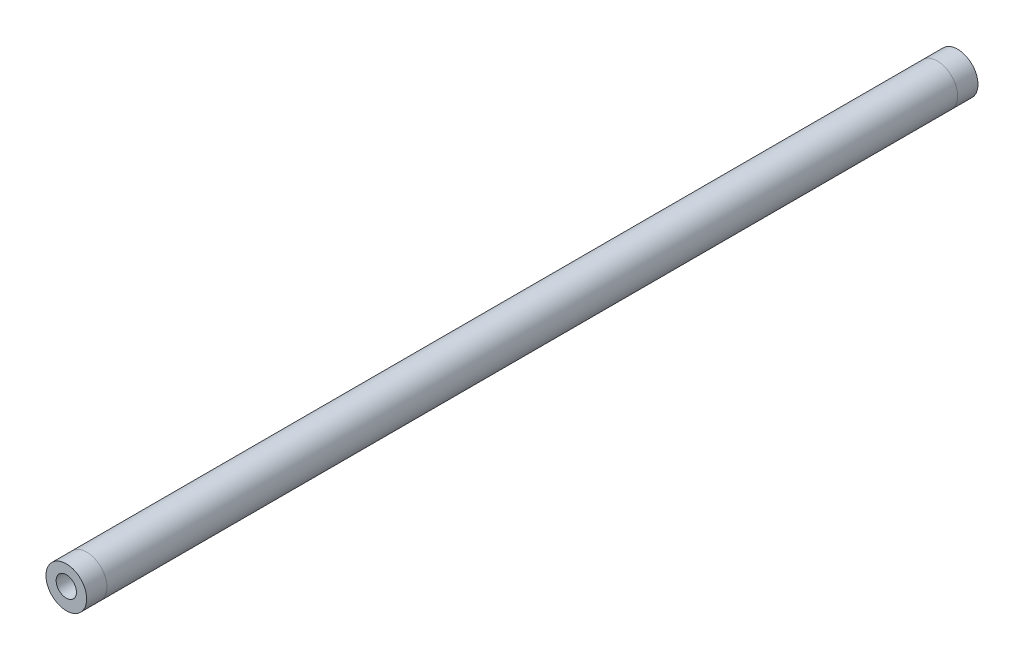
from build123d import *

# Parameters (mm, degrees)
THREADED_START            = -21.9075
SKETCH2_R                 = 6.35
SKETCH2_R_2               = 4.7625
SKETCH2_R_3               = 3.175
THREADED_INSERT_1_1_DEPTH = 6.35
THREADED_START_2          = -28.2575
SKETCH2_5_R               = 4.7625
SKETCH2_5_R_2             = 3.175
THREADED_INSERT_1_2_DEPTH = 9.525
BOSS_EXTRUDE4_START       = -300.081848
SKETCH2_7_R               = 6.35
SKETCH2_7_R_2             = 4.7625
SKETCH2_7_R_3             = 3.175
BOSS_EXTRUDE4_DEPTH       = 6.35
BOSS_EXTRUDE5_START       = -284.206848
SKETCH2_8_R               = 4.7625
SKETCH2_8_R_2             = 3.175
BOSS_EXTRUDE5_DEPTH       = 9.525
BOSS_EXTRUDE6_START       = -28.2575
SKETCH2_9_R               = 6.35
SKETCH2_9_R_2             = 4.7625
BOSS_EXTRUDE6_DEPTH       = 265.4743484


with BuildPart() as part:
    # Sketch2 → Threaded Insert 1-1 (new body)
    # profile 1 of 2: a face of its own
    with BuildSketch(Plane.XY.offset(THREADED_START)):
        Circle(SKETCH2_R)
        Circle(SKETCH2_R_2, mode=Mode.SUBTRACT)
    # profile 2 of 2: a face of its own
    with BuildSketch(Plane.XY.offset(THREADED_START)):
        Circle(SKETCH2_R_2)
        with Locations((0, 0.235008439)):
            Circle(SKETCH2_R_3, mode=Mode.SUBTRACT)
    extrude(amount=-THREADED_INSERT_1_1_DEPTH)

    # Sketch2<5> → Threaded Insert 1-2 (add)
    with BuildSketch(Plane.XY.offset(THREADED_START_2)):
        Circle(SKETCH2_5_R)
        with Locations((0, 0.235008439)):
            Circle(SKETCH2_5_R_2, mode=Mode.SUBTRACT)
    extrude(amount=-THREADED_INSERT_1_2_DEPTH)


with BuildPart() as body_2:
    # Sketch2<7> → Boss-Extrude4 (new body)
    # profile 1 of 2: a face of its own
    with BuildSketch(Plane.XY.offset(BOSS_EXTRUDE4_START)):
        Circle(SKETCH2_7_R)
        Circle(SKETCH2_7_R_2, mode=Mode.SUBTRACT)
    # profile 2 of 2: a face of its own
    with BuildSketch(Plane.XY.offset(BOSS_EXTRUDE4_START)):
        Circle(SKETCH2_7_R_2)
        with Locations((0, 0.235008439)):
            Circle(SKETCH2_7_R_3, mode=Mode.SUBTRACT)
    extrude(amount=BOSS_EXTRUDE4_DEPTH)

    # Sketch2<8> → Boss-Extrude5 (add)
    with BuildSketch(Plane.XY.offset(BOSS_EXTRUDE5_START)):
        with Locations(Location((0, 0, 0), (0, 0, 180))):
            Circle(SKETCH2_8_R)
        with Locations((0, 0.235008439)):
            Circle(SKETCH2_8_R_2, mode=Mode.SUBTRACT)
    extrude(amount=-BOSS_EXTRUDE5_DEPTH)


with BuildPart() as body_3:
    # Sketch2<9> → Boss-Extrude6 (new body)
    with BuildSketch(Plane.XY.offset(BOSS_EXTRUDE6_START)):
        Circle(SKETCH2_9_R)
        Circle(SKETCH2_9_R_2, mode=Mode.SUBTRACT)
    extrude(amount=-BOSS_EXTRUDE6_DEPTH)


solid = Compound([part.part, body_2.part, body_3.part])
